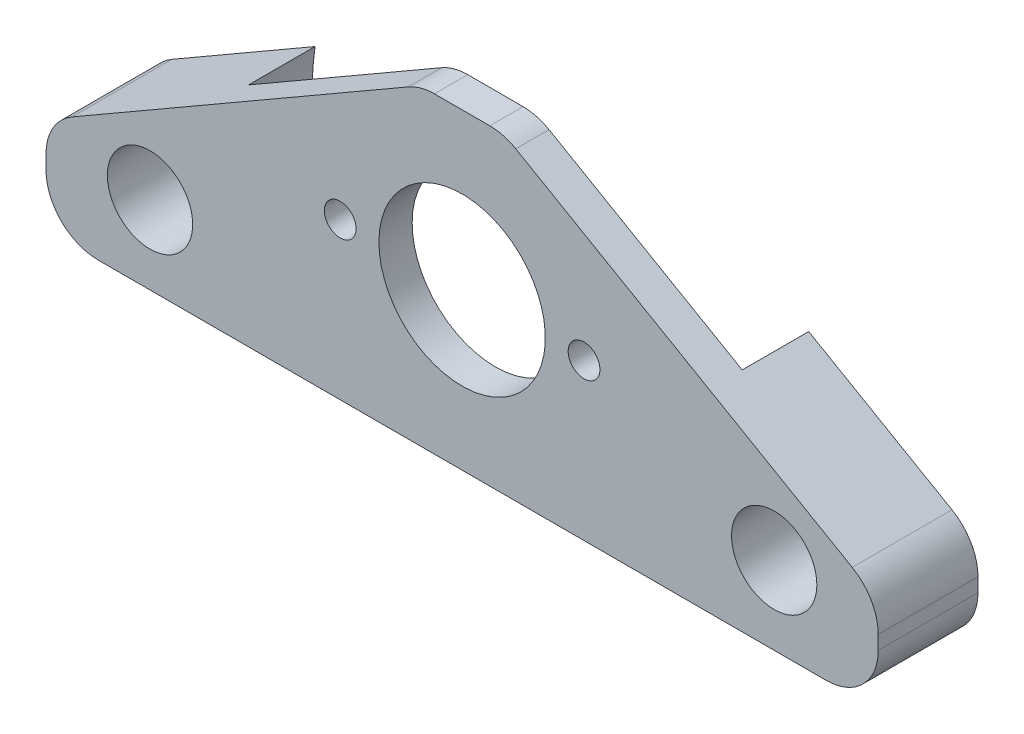
from build123d import *

# Parameters (mm, degrees)
EXTRUDE1_START = -1
EXTRUDE1_DEPTH = 2.03
EXTRUDE2_DEPTH = 4.06
SKETCH4_R      = 5.08
SKETCH4_R_2    = 2.6035
SKETCH4_R_3    = 0.97028
EXTRUDE3_DEPTH = 33.328789028
FILLET1_R      = 3.175


with BuildPart() as part:
    # Sketch1 → Extrude1 (new body)
    with BuildSketch(Plane.XY.offset(EXTRUDE1_START)):
        Polygon((0, 19.05), (0, 0), (25.4, 0), (25.4, 5.851775032), (2.540003786, 19.05), align=None)
    extrude(amount=-EXTRUDE1_DEPTH)

    # Sketch2 → Extrude2 (add)
    with BuildSketch(Plane(origin=(0, 0, -3.03), x_dir=(-1, 0, 0), z_dir=(0, 0, -1))):
        with BuildLine():
            Line((-11.896721187, 0), (-25.4, 0))
            Line((-25.4, 0), (-25.4, 5.851775032))
            Line((-25.4, 5.851775032), (-15.066541319, 11.817800183))
            ThreePointArc((-15.066541319, 11.817800183), (-14.71969706, 5.576820867), (-11.896721187, 0))
        make_face()
    extrude(amount=EXTRUDE2_DEPTH)

    # Sketch4 → Extrude3 (cut, through all)
    with BuildSketch(Plane(origin=(0, 0, -7.09), x_dir=(-1, 0, 0), z_dir=(0, 0, -1))):
        with Locations((0, 9.525)):
            Circle(SKETCH4_R)
        with Locations(Location((-19.05, 4.7625, 0), (0, 0, 180))):
            Circle(SKETCH4_R_2)
        with Locations(Location((-7.4422, 9.525, 0), (0, 0, 180))):
            Circle(SKETCH4_R_3)
    extrude(amount=-EXTRUDE3_DEPTH, mode=Mode.SUBTRACT)

    # Fillet1
    fillet1_edges = [part.edges().sort_by_distance(p)[0] for p in [
        (2.540003786, 19.05, -2.015),
        (25.4, 5.851775032, -4.045),
        (25.4, 0, -4.045),
    ]]
    fillet(fillet1_edges, radius=FILLET1_R)

    # Mirror1: part across plane


with BuildPart() as part_1:
    add(part.part)
    add(part.part.mirror(Plane(origin=(0, 19.05, -3.03), x_dir=(0, 0, 1), z_dir=(-1, 0, 0))))


solid = part_1.part
